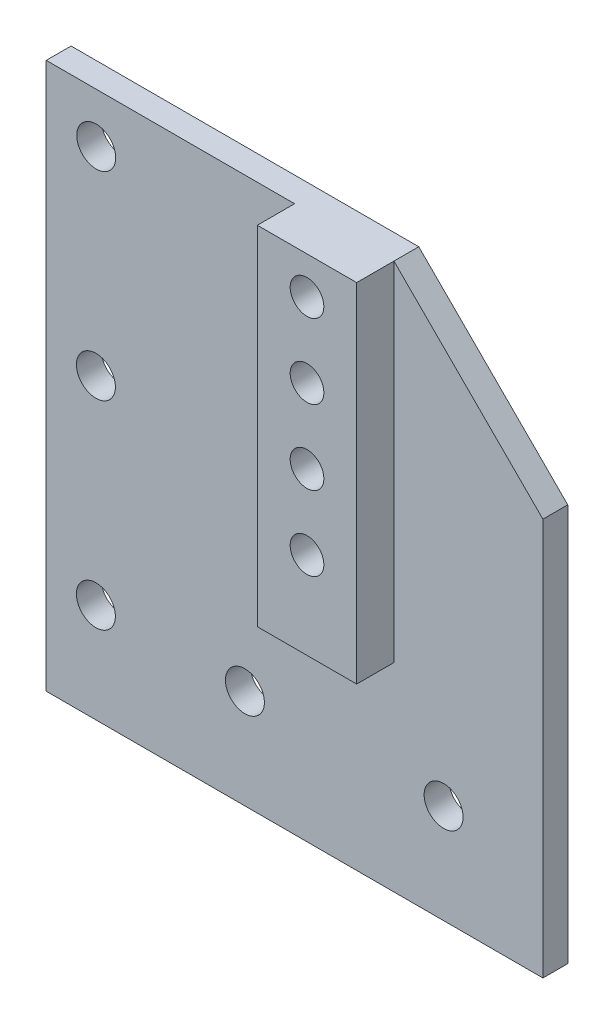
from build123d import *

# Parameters (mm, degrees)
BOSS_EXTRUDE1_DEPTH    = 3.175
F_10_CLEARANCE_HOLE1_D = 4.9784
BOSS_EXTRUDE2_DEPTH    = 4.7625
F_8_CLEARANCE_HOLE1_D  = 4.3053


with BuildPart() as part:
    # Sketch1 → Boss-Extrude1 (new body)
    with BuildSketch(Plane.XY):
        Polygon((-254.000000508, -12.7), (-266.700000508, -12.7), (-266.700000508, 57.15), (-254.000000508, 57.15), (-222.250000508, 57.15), (-203.200000508, 38.1), (-203.200000508, 12.7), (-203.200000508, -12.7), align=None)
    extrude(amount=BOSS_EXTRUDE1_DEPTH)

    # #10 Clearance Hole1 (through all)
    with Locations(Plane.XY.offset(3.175)):
        with Locations((-260.311771093, 50.798866939), (-260.350000508, 25.4), (-260.350000508, 0), (-241.300000508, 0), (-215.900000508, 0)):
            Hole(F_10_CLEARANCE_HOLE1_D / 2)

    # Sketch5 → Boss-Extrude2 (add)
    with BuildSketch(Plane.XY.offset(3.175)):
        Polygon((-222.250000508, 57.15), (-234.950000508, 57.15), (-234.950000508, 12.7), (-222.250000508, 12.7), (-222.250000508, 50.8), align=None)
    extrude(amount=BOSS_EXTRUDE2_DEPTH)

    # #8 Clearance Hole1 (through all)
    with Locations(Plane.XY.offset(7.9375)):
        with Locations((-228.600000508, 42.8625), (-228.600000508, 52.3875), (-228.600000508, 33.3375), (-228.600000508, 23.8125)):
            Hole(F_8_CLEARANCE_HOLE1_D / 2)


solid = part.part
